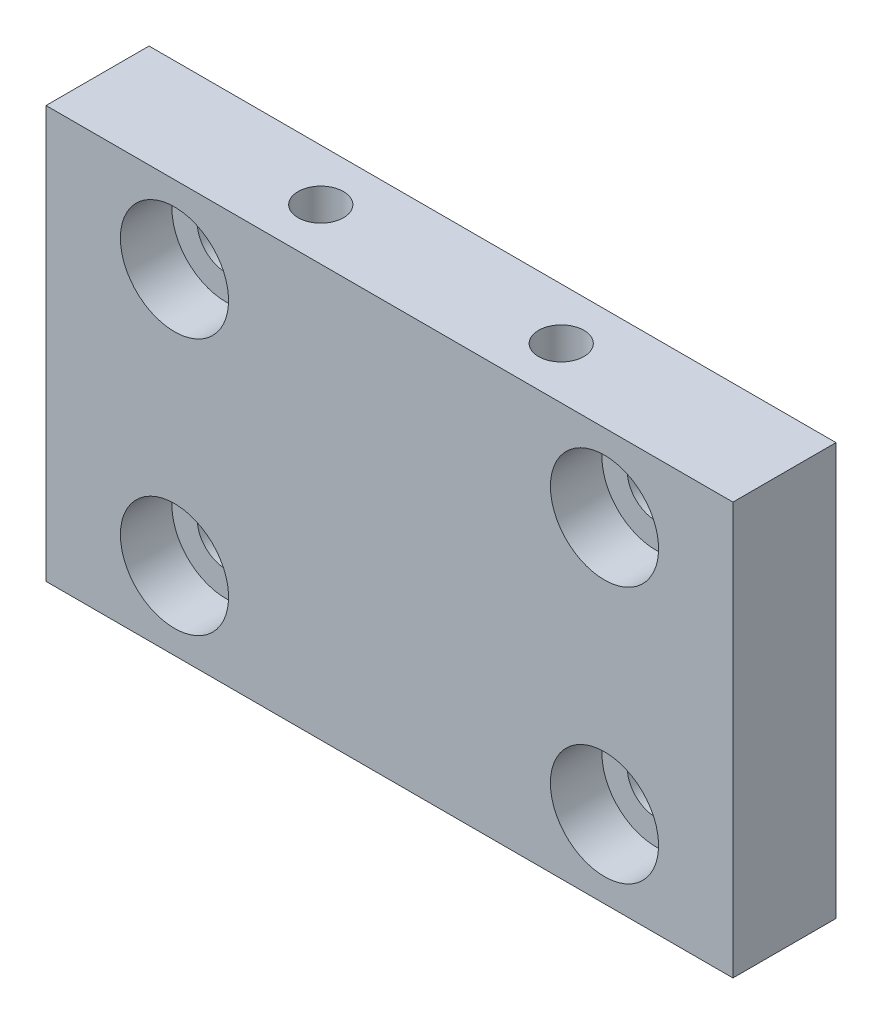
from build123d import *

# Parameters (mm, degrees)
SKETCH1_W               = 63.5
SKETCH1_H               = 38.1
SKETCH1_R               = 2.6543
BOSS_EXTRUDE1_DEPTH     = 9.525
CUT_EXTRUDE2_DEPTH      = 39.232062788
CUT_EXTRUDE2_DEPTH_BACK = 4.7625
SKETCH4_R               = 5
CUT_EXTRUDE3_DEPTH      = 39.232062788
CUT_EXTRUDE3_DEPTH_BACK = 39.232062788
SKETCH5_R               = 2.1


with BuildPart() as part:
    # Sketch1 → Boss-Extrude1 (new body)
    with BuildSketch(Plane.XY):
        Rectangle(SKETCH1_W, SKETCH1_H)
        with Locations(Location((-19.875, 11.875, 0), (0, 0, 180))):
            Circle(SKETCH1_R, mode=Mode.SUBTRACT)
        with Locations(Location((-19.875, -11.875, 0), (0, 0, 180))):
            Circle(SKETCH1_R, mode=Mode.SUBTRACT)
        with Locations(Location((19.875, -11.875, 0), (0, 0, 180))):
            Circle(SKETCH1_R, mode=Mode.SUBTRACT)
        with Locations(Location((19.875, 11.875, 0), (0, 0, 180))):
            Circle(SKETCH1_R, mode=Mode.SUBTRACT)
    extrude(amount=BOSS_EXTRUDE1_DEPTH)

    # Sketch4 → Cut-Extrude2 (cut, two sides: drawn at the far end of the back side and taken through both)
    with BuildSketch(Plane.XY.offset(9.525).offset(-CUT_EXTRUDE2_DEPTH_BACK)):
        with Locations(Location((19.875, -11.875, 0), (0, 0, 180))):
            Circle(SKETCH4_R)
        with Locations(Location((19.875, 11.875, 0), (0, 0, 180))):
            Circle(SKETCH4_R)
        with Locations(Location((-19.875, 11.875, 0), (0, 0, 180))):
            Circle(SKETCH4_R)
        with Locations(Location((-19.875, -11.875, 0), (0, 0, 180))):
            Circle(SKETCH4_R)
    extrude(amount=CUT_EXTRUDE2_DEPTH + CUT_EXTRUDE2_DEPTH_BACK, mode=Mode.SUBTRACT)

    # Sketch5 → Cut-Extrude3 (cut, two sides: drawn at the far end of the back side and taken through both)
    with BuildSketch(Plane(origin=(0, 0, 0), x_dir=(1, 0, 0), z_dir=(0, 1, 0)).offset(-CUT_EXTRUDE3_DEPTH_BACK)):
        with Locations(Location((-11.1125, -4.7625, 0), (0, 0, 270))):
            Circle(SKETCH5_R)
        with Locations(Location((11.1125, -4.7625, 0), (0, 0, 90))):
            Circle(SKETCH5_R)
    extrude(amount=CUT_EXTRUDE3_DEPTH + CUT_EXTRUDE3_DEPTH_BACK, mode=Mode.SUBTRACT)


solid = part.part
